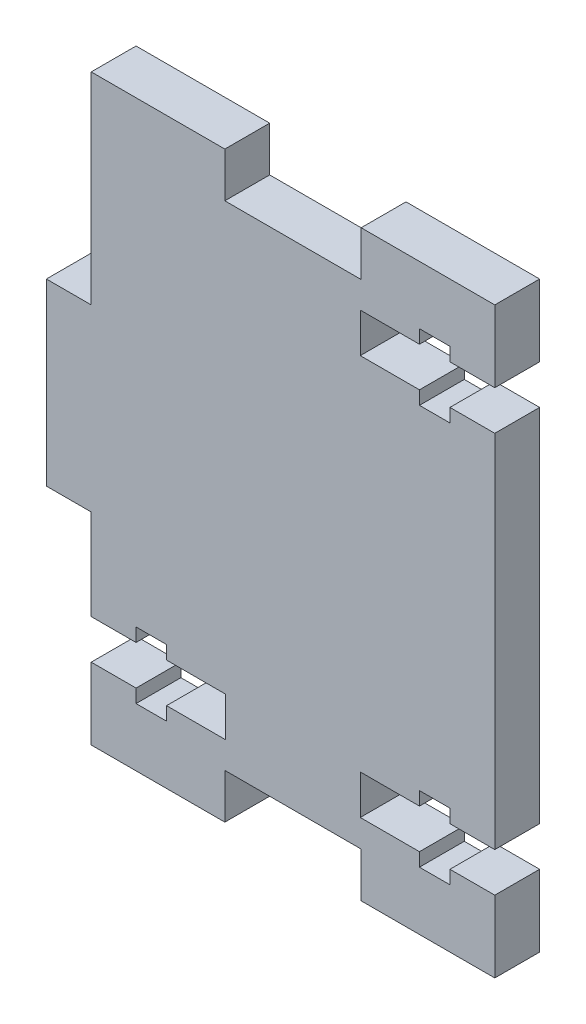
from build123d import *

# Parameters (mm, degrees)
BOSS_EXTRUDE1_DEPTH = 5
CUT_EXTRUDE1_DEPTH  = 5
SKETCH4_W           = 15.2
SKETCH4_H           = 5
CUT_EXTRUDE2_DEPTH  = 10


with BuildPart() as part:
    # Sketch1 → Boss-Extrude1 (new body)
    with BuildSketch(Plane.XY):
        Polygon((-22.5, 32.5), (0, 32.5), (22.5, 32.5), (22.5, -32.5), (-22.5, -32.5), (-22.5, -10), (-27.5, -10), (-27.5, 10), (-22.5, 10), align=None)
    extrude(amount=BOSS_EXTRUDE1_DEPTH)

    # Sketch3 → Cut-Extrude1 (cut)
    with BuildSketch(Plane.XY.offset(5)):
        Polygon((22.5, 24.5), (17.5, 24.5), (17.5, 26), (14.1, 26), (14.1, 24.5), (7.5, 24.5), (7.5, 20.1), (14.1, 20.1), (14.1, 18.6), (17.5, 18.6), (17.5, 20.1), (22.5, 20.1), align=None)
        Polygon((22.5, -24.5), (22.5, -20.1), (17.5, -20.1), (17.5, -18.6), (14.1, -18.6), (14.1, -20.1), (7.5, -20.1), (7.5, -24.5), (14.1, -24.5), (14.1, -26), (17.5, -26), (17.5, -24.5), align=None)
        Polygon((-22.5, -24.5), (-17.5, -24.5), (-17.5, -26), (-14.1, -26), (-14.1, -24.5), (-7.5, -24.5), (-7.5, -20.1), (-14.1, -20.1), (-14.1, -18.6), (-17.5, -18.6), (-17.5, -20.1), (-22.5, -20.1), align=None)
    extrude(amount=-CUT_EXTRUDE1_DEPTH, mode=Mode.SUBTRACT)

    # Sketch4 → Cut-Extrude2 (cut)
    with BuildSketch(Plane.XY.offset(5)):
        with Locations((0, -30)):
            Rectangle(SKETCH4_W, SKETCH4_H)
        with Locations((0, 30)):
            Rectangle(SKETCH4_W, SKETCH4_H)
    extrude(amount=-CUT_EXTRUDE2_DEPTH, mode=Mode.SUBTRACT)


solid = part.part
